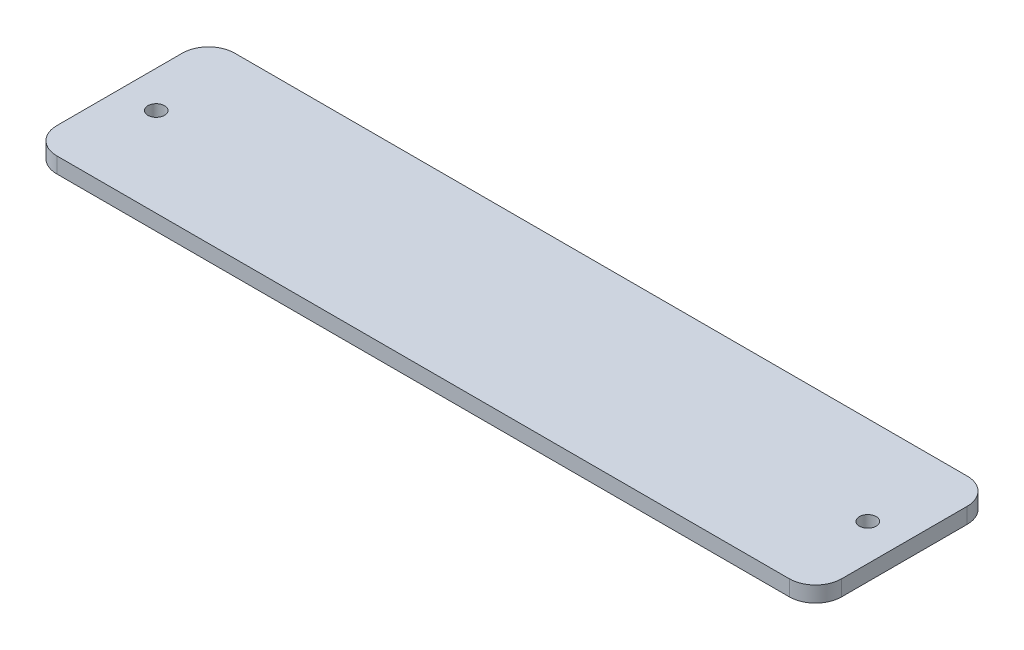
from build123d import *

# Parameters (mm, degrees)
SKETCH_1_W      = 150
SKETCH_1_H      = 34
SKETCH_1_R      = 1.6
EXTRUDE_1_DEPTH = 3
FILLET_1_R      = 5


with BuildPart() as part:
    # ｽｹｯﾁ1 → ﾎﾞｽ - 押し出し1 (new body)
    with BuildSketch(Plane(origin=(0, 0, 0), x_dir=(1, 0, 0), z_dir=(0, 1, 0))):
        with Locations((75, 25)):
            Rectangle(SKETCH_1_W, SKETCH_1_H)
        with Locations(Location((143, 25, 0), (0, 0, 90))):
            Circle(SKETCH_1_R, mode=Mode.SUBTRACT)
        with Locations(Location((7, 25, 0), (0, 0, 270))):
            Circle(SKETCH_1_R, mode=Mode.SUBTRACT)
    extrude(amount=EXTRUDE_1_DEPTH)

    # ﾌｨﾚｯﾄ1
    fillet_1_edges = [part.edges().sort_by_distance(p)[0] for p in [
        (0, 1.5, -42),
        (150, 1.5, -42),
        (150, 1.5, -8),
        (0, 1.5, -8),
    ]]
    fillet(fillet_1_edges, radius=FILLET_1_R)


solid = part.part
